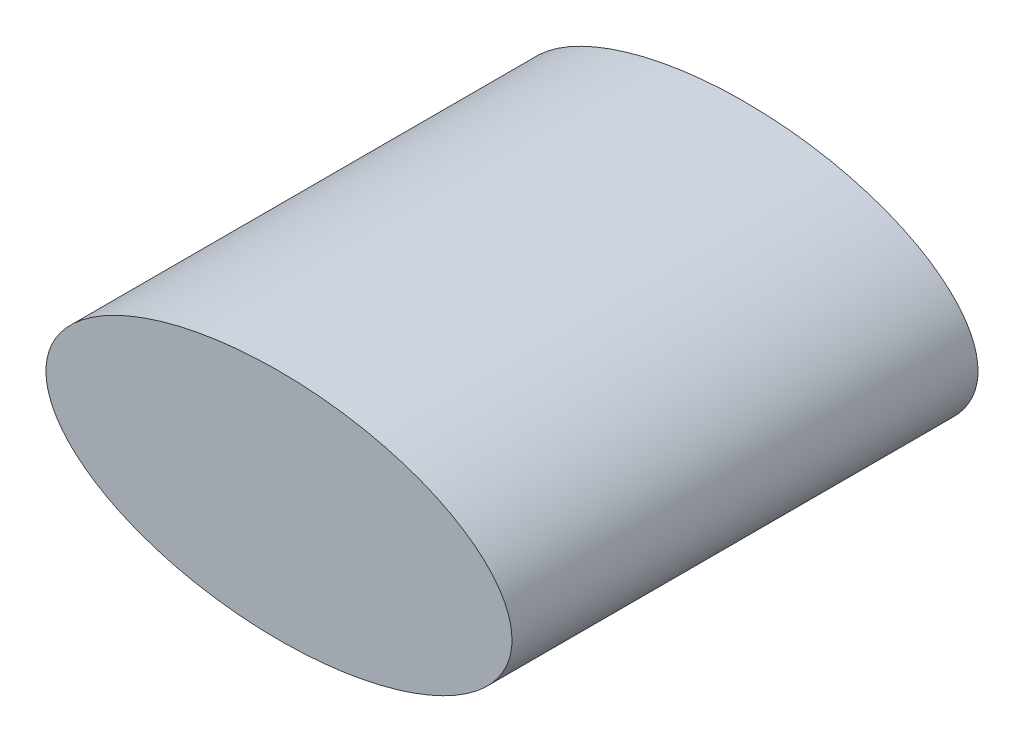
from build123d import *

# Parameters (mm, degrees)
SKETCH_MAIN_PROFILE_RX          = 10
SKETCH_MAIN_PROFILE_RY          = 5
FEATURE_ELLIPSE_EXTRUSION_DEPTH = 20


with BuildPart() as part:
    # sketch:main-profile → feature:ellipse-extrusion (new body)
    with BuildSketch(Plane.XY):
        with Locations((0, 0)):
            Ellipse(SKETCH_MAIN_PROFILE_RX, SKETCH_MAIN_PROFILE_RY)
    extrude(amount=FEATURE_ELLIPSE_EXTRUSION_DEPTH)


solid = part.part
